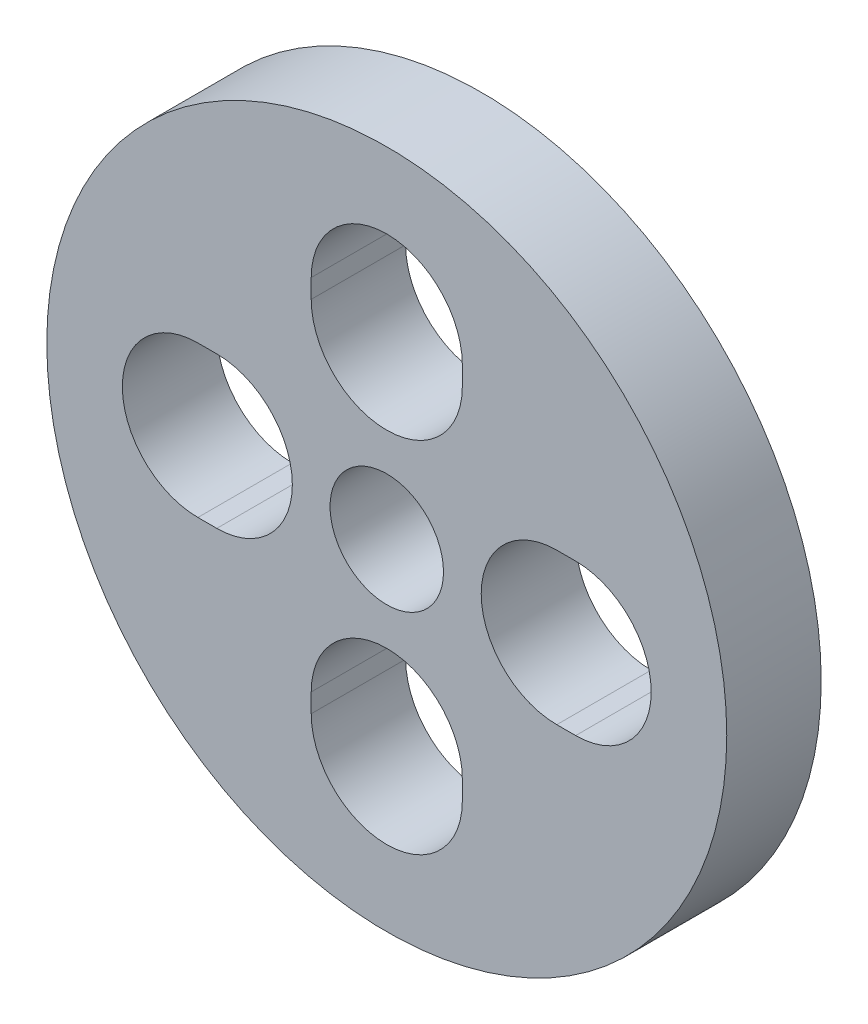
from build123d import *

# Parameters (mm, degrees)
ESQUISSE1_R             = 18
ESQUISSE1_R_2           = 3.0025
BOSS_EXTRU_1_DEPTH      = 5
ENL_V_MAT_EXTRU_1_DEPTH = 5


with BuildPart() as part:
    # Esquisse1 → Boss.-Extru.1 (new body)
    with BuildSketch(Plane.XY):
        Circle(ESQUISSE1_R)
        Circle(ESQUISSE1_R_2, mode=Mode.SUBTRACT)
    extrude(amount=BOSS_EXTRU_1_DEPTH)

    # Esquisse2 → Enlèv. mat.-Extru.1 (cut)
    with BuildSketch(Plane.XY.offset(5)):
        with BuildLine():
            Line((-4, 10), (-4, 9))
            ThreePointArc((-4, 9), (0, 5), (4, 9))
            Line((4, 9), (4, 10))
            ThreePointArc((4, 10), (0, 14), (-4, 10))
        make_face()
        with BuildLine():
            Line((-10, -4), (-9, -4))
            ThreePointArc((-9, -4), (-5, 0), (-9, 4))
            Line((-9, 4), (-10, 4))
            ThreePointArc((-10, 4), (-14, 0), (-10, -4))
        make_face()
        with BuildLine():
            Line((4, -10), (4, -9))
            ThreePointArc((4, -9), (0, -5), (-4, -9))
            Line((-4, -9), (-4, -10))
            ThreePointArc((-4, -10), (0, -14), (4, -10))
        make_face()
        with BuildLine():
            Line((10, 4), (9, 4))
            ThreePointArc((9, 4), (5, 0), (9, -4))
            Line((9, -4), (10, -4))
            ThreePointArc((10, -4), (14, 0), (10, 4))
        make_face()
    extrude(amount=-ENL_V_MAT_EXTRU_1_DEPTH, mode=Mode.SUBTRACT)


solid = part.part
